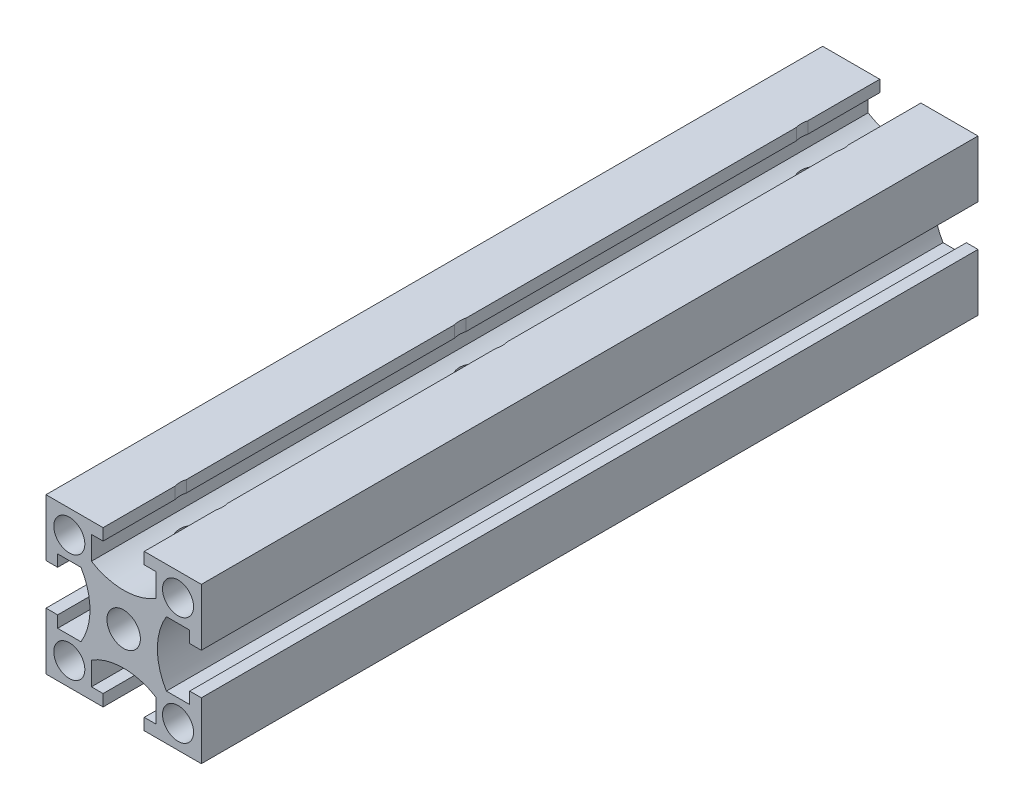
from build123d import *

# Parameters (mm, degrees)
SKETCH_1_W          = 20
SKETCH_1_H          = 20
EXTRUDE_1_DEPTH     = 100
SKETCH_2_R          = 2.15
SKETCH_2_R_2        = 2
CUT_EXTRUDE_1_DEPTH = 300
HOLE_WIZARD_M5_1_D  = 5.5


with BuildPart() as part:
    # 스케치1 → 보스-돌출1 (new body)
    with BuildSketch(Plane.XY):
        Rectangle(SKETCH_1_W, SKETCH_1_H)
    extrude(amount=EXTRUDE_1_DEPTH)

    # 스케치2 → 컷-돌출1 (cut)
    with BuildSketch(Plane.XY.offset(100)):
        Circle(SKETCH_2_R)
        with Locations((-7, 7)):
            Circle(SKETCH_2_R_2)
        with Locations((7, 7)):
            Circle(SKETCH_2_R_2)
        with Locations((7, -7)):
            Circle(SKETCH_2_R_2)
        with Locations((-7, -7)):
            Circle(SKETCH_2_R_2)
        with BuildLine():
            Line((-2.65, 10), (-2.65, 8.5))
            Line((-2.65, 8.5), (-4.15, 8.5))
            Line((-4.15, 8.5), (-4.15, 5.5))
            ThreePointArc((-4.15, 5.5), (0, 4.339407869), (4.15, 5.5))
            Line((4.15, 5.5), (4.15, 8.5))
            Line((4.15, 8.5), (2.65, 8.5))
            Line((2.65, 8.5), (2.65, 10))
            Line((2.65, 10), (-2.65, 10))
        make_face()
        with BuildLine():
            Line((10, 2.65), (8.5, 2.65))
            Line((8.5, 2.65), (8.5, 4.15))
            Line((8.5, 4.15), (5.5, 4.15))
            ThreePointArc((5.5, 4.15), (4.339407869, 0), (5.5, -4.15))
            Line((5.5, -4.15), (8.5, -4.15))
            Line((8.5, -4.15), (8.5, -2.65))
            Line((8.5, -2.65), (10, -2.65))
            Line((10, -2.65), (10, 2.65))
        make_face()
        with BuildLine():
            Line((2.65, -10), (2.65, -8.5))
            Line((2.65, -8.5), (4.15, -8.5))
            Line((4.15, -8.5), (4.15, -5.5))
            ThreePointArc((4.15, -5.5), (0, -4.339407869), (-4.15, -5.5))
            Line((-4.15, -5.5), (-4.15, -8.5))
            Line((-4.15, -8.5), (-2.65, -8.5))
            Line((-2.65, -8.5), (-2.65, -10))
            Line((-2.65, -10), (2.65, -10))
        make_face()
        with BuildLine():
            Line((-10, -2.65), (-8.5, -2.65))
            Line((-8.5, -2.65), (-8.5, -4.15))
            Line((-8.5, -4.15), (-5.5, -4.15))
            ThreePointArc((-5.5, -4.15), (-4.339407869, 0), (-5.5, 4.15))
            Line((-5.5, 4.15), (-8.5, 4.15))
            Line((-8.5, 4.15), (-8.5, 2.65))
            Line((-8.5, 2.65), (-10, 2.65))
            Line((-10, 2.65), (-10, -2.65))
        make_face()
    extrude(amount=-CUT_EXTRUDE_1_DEPTH, mode=Mode.SUBTRACT)

    # M5 여유 구멍1 (through all)
    with Locations(Plane(origin=(0, 10, 0), x_dir=(1, 0, 0), z_dir=(0, 1, 0))):
        with Locations((0, -10), (0, -90), (0, -54)):
            Hole(HOLE_WIZARD_M5_1_D / 2)


solid = part.part
